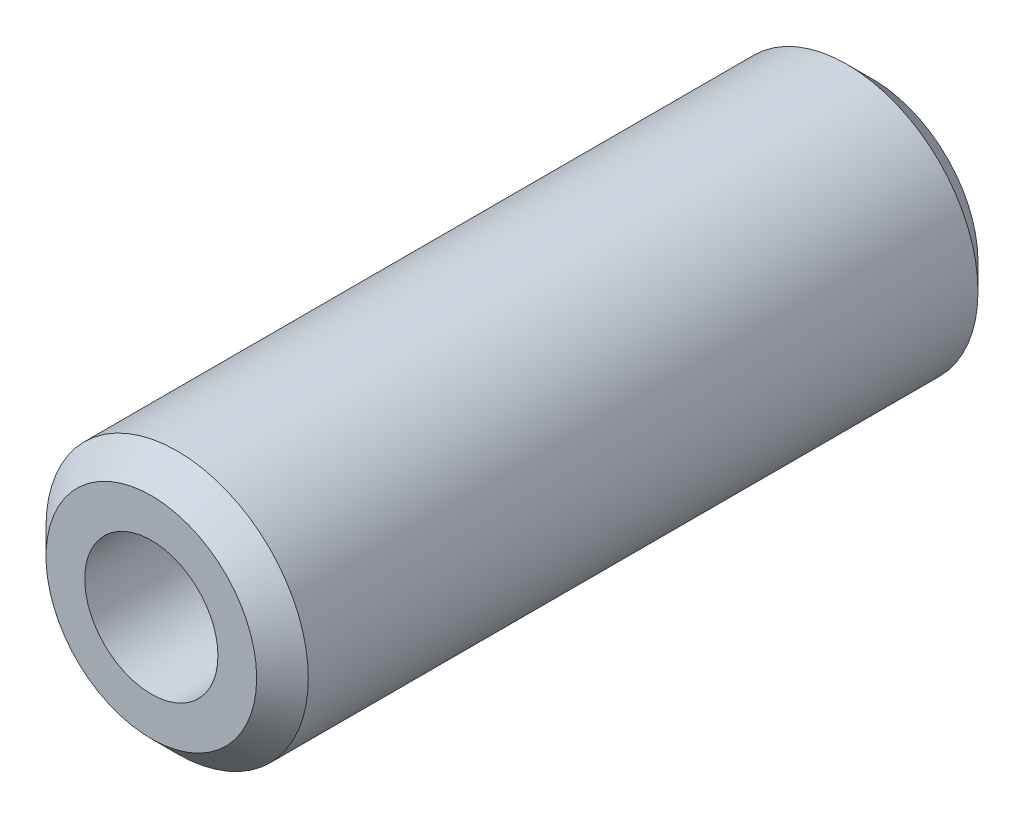
from build123d import *

# Parameters (mm, degrees)
SKETCH1_R           = 12.7
SKETCH1_R_2         = 6.45
BOSS_EXTRUDE1_DEPTH = 69.85
CHAMFER1_SIZE       = 2.5


with BuildPart() as part:
    # Sketch1 → Boss-Extrude1 (new body)
    with BuildSketch(Plane.XY):
        Circle(SKETCH1_R)
        Circle(SKETCH1_R_2, mode=Mode.SUBTRACT)
    extrude(amount=BOSS_EXTRUDE1_DEPTH)

    # Chamfer1
    chamfer1_edges = [part.edges().sort_by_distance(p)[0] for p in [
        (-12.7, 0, 0),
        (-12.7, 0, 69.85),
    ]]
    chamfer(chamfer1_edges, length=CHAMFER1_SIZE)


solid = part.part
